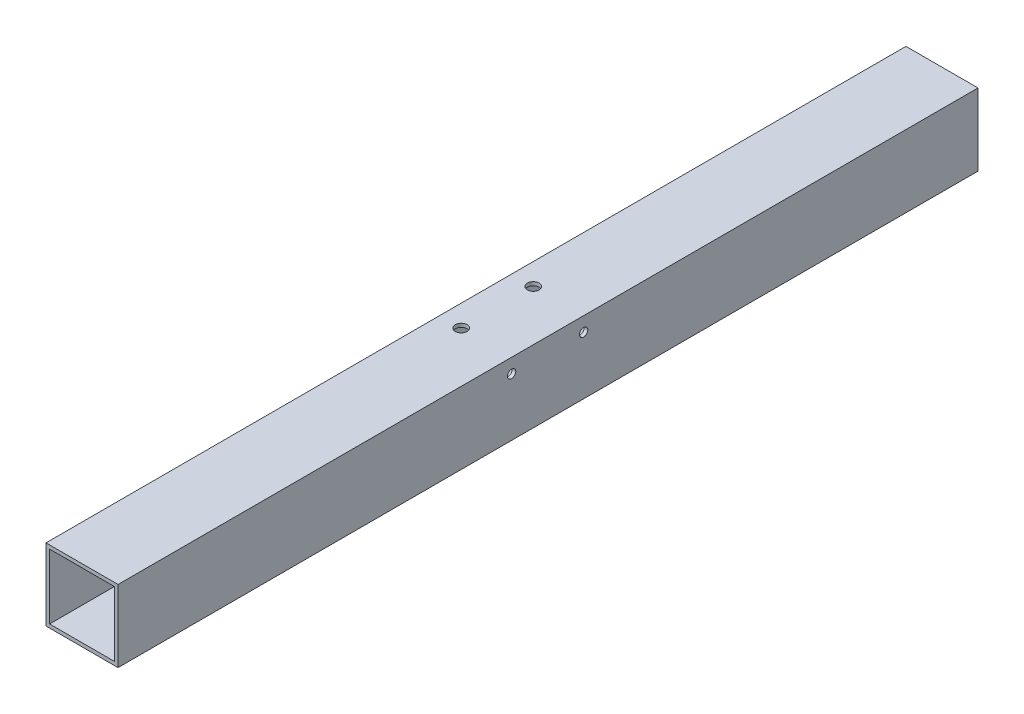
from build123d import *

# Parameters (mm, degrees)
SKETCH1_W               = 20
SKETCH1_H               = 20
SKETCH1_W_2             = 18
SKETCH1_H_2             = 18
BOSS_EXTRUDE2_DEPTH     = 238.73
CUT_EXTRUDE1_DEPTH      = 240.774921332
CUT_EXTRUDE1_DEPTH_BACK = 240.774921332
SKETCH3_R               = 1.65
CUT_EXTRUDE2_DEPTH      = 240.774921332
CUT_EXTRUDE2_DEPTH_BACK = 240.774921332
SKETCH4_R               = 1.15


with BuildPart() as part:
    # Sketch1 → Boss-Extrude2 (new body)
    with BuildSketch(Plane.XY):
        Rectangle(SKETCH1_W, SKETCH1_H)
        Rectangle(SKETCH1_W_2, SKETCH1_H_2, mode=Mode.SUBTRACT)
    extrude(amount=BOSS_EXTRUDE2_DEPTH)

    # Sketch3 → Cut-Extrude1 (cut, two sides: drawn at the far end of the back side and taken through both)
    with BuildSketch(Plane(origin=(0, 10, 0), x_dir=(1, 0, 0), z_dir=(0, 1, 0)).offset(-CUT_EXTRUDE1_DEPTH_BACK)):
        with Locations(Location((-4, -109.46, 0), (0, 0, 270))):
            Circle(SKETCH3_R)
        with Locations(Location((-4, -129.46, 0), (0, 0, 270))):
            Circle(SKETCH3_R)
    extrude(amount=CUT_EXTRUDE1_DEPTH + CUT_EXTRUDE1_DEPTH_BACK, mode=Mode.SUBTRACT)

    # Sketch4 → Cut-Extrude2 (cut, two sides: drawn at the far end of the back side and taken through both)
    with BuildSketch(Plane.ZY.offset(10).offset(-CUT_EXTRUDE2_DEPTH_BACK)):
        with Locations(Location((129.47, 6, 0), (0, 0, 180))):
            Circle(SKETCH4_R)
        with Locations(Location((109.47, 6, 0), (0, 0, 180))):
            Circle(SKETCH4_R)
    extrude(amount=CUT_EXTRUDE2_DEPTH + CUT_EXTRUDE2_DEPTH_BACK, mode=Mode.SUBTRACT)


solid = part.part
